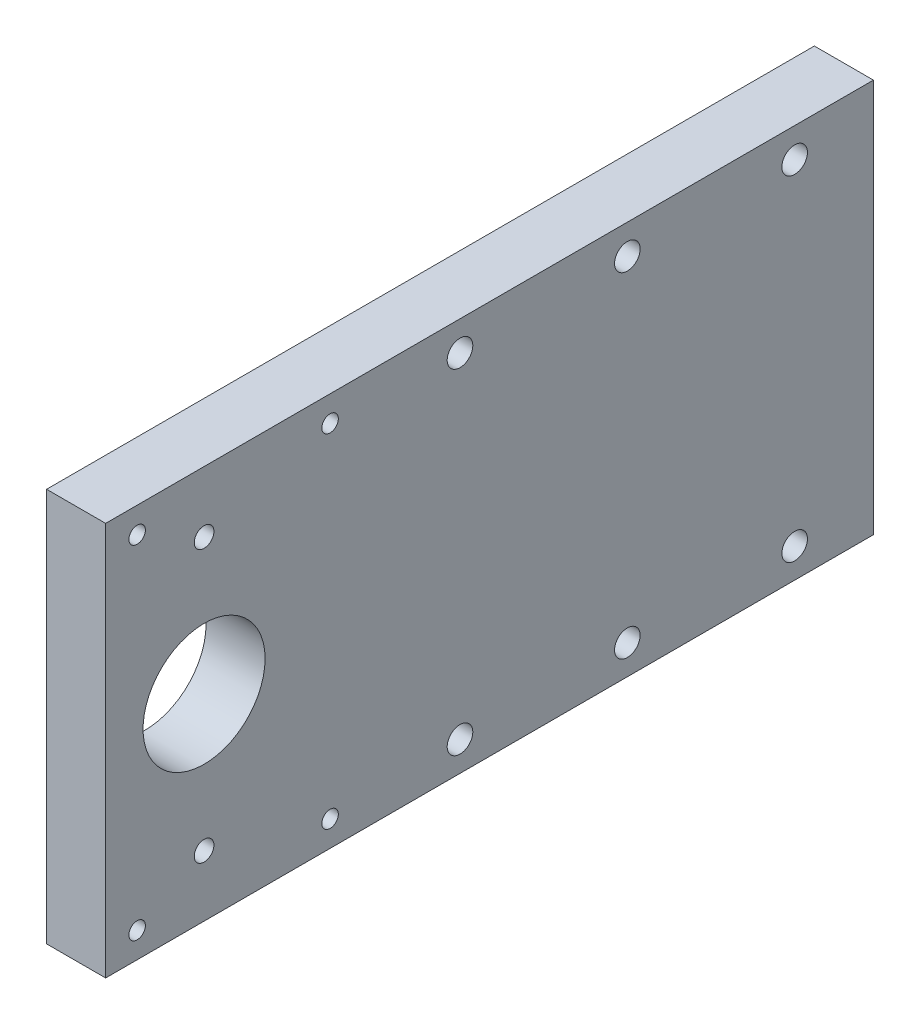
from build123d import *

# Parameters (mm, degrees)
SKETCH11_W                 = 195
SKETCH11_H                 = 100
BOSS_EXTRUDE2_DEPTH        = 15
SKETCH2_R                  = 15.5
CUT_EXTRUDE1_DEPTH         = 202.866292382
M6_TAPPED_HOLE1_D          = 5
M6_TAPPED_HOLE1_DEPTH      = 12
M6_TAPPED_HOLE1_TIP        = 1.502151548
F_6_5_6_5_DIAMETER_HOLE1_D = 6.5
M5_TAPPED_HOLE1_D          = 4.2
M5_TAPPED_HOLE1_DEPTH      = 12
M5_TAPPED_HOLE1_TIP        = 1.2618073
M6_TAPPED_HOLE2_D          = 5


with BuildPart() as part:
    # Sketch11 → Boss-Extrude2 (new body)
    with BuildSketch(Plane(origin=(0, 0, 0), x_dir=(0, 0, -1), z_dir=(1, 0, 0))):
        with Locations((-97.5, 0)):
            Rectangle(SKETCH11_W, SKETCH11_H)
    extrude(amount=-BOSS_EXTRUDE2_DEPTH)

    # Sketch2 → Cut-Extrude1 (cut, through all)
    with BuildSketch(Plane(origin=(0, 0, 0), x_dir=(0, 0, -1), z_dir=(1, 0, 0))):
        with Locations((-170, 0)):
            Circle(SKETCH2_R)
    extrude(amount=-CUT_EXTRUDE1_DEPTH, mode=Mode.SUBTRACT)

    # M6 Tapped Hole1
    with Locations(Plane(origin=(-11.981616001, -34.658638116, 0), x_dir=(-1, 0, 0), z_dir=(0, 0, -1))):
        with Locations((-4.481616001, -0.341361884), (-4.481616001, 69.658638116)):
            Hole(M6_TAPPED_HOLE1_D / 2, depth=M6_TAPPED_HOLE1_DEPTH)
            with Locations((0, 0, -(M6_TAPPED_HOLE1_DEPTH + M6_TAPPED_HOLE1_TIP / 2))):  # 118° drill point
                Cone(0, M6_TAPPED_HOLE1_D / 2, M6_TAPPED_HOLE1_TIP, mode=Mode.SUBTRACT)

    # Ø6.5 (6.5) Diameter Hole1 (through all)
    with Locations(Plane(origin=(0, -7.362824857, 24.874407607), x_dir=(0, 0, -1), z_dir=(1, 0, 0))):
        with Locations((-80.125592393, -35.137175143), (-37.625592393, -35.137175143), (4.874407607, -35.137175143), (-80.125592393, 49.862824857), (-37.625592393, 49.862824857), (4.874407607, 49.862824857)):
            Hole(F_6_5_6_5_DIAMETER_HOLE1_D / 2)

    # M5 Tapped Hole1
    with Locations(Plane(origin=(0, -36.291159976, 74.046897255), x_dir=(0, 0, 1), z_dir=(1, 0, 0))):
        with Locations((63.953102745, 7.208840024), (112.953102745, 7.208840024), (112.953102745, -79.791159976), (63.953102745, -79.791159976)):
            Hole(M5_TAPPED_HOLE1_D / 2, depth=M5_TAPPED_HOLE1_DEPTH)
            with Locations((0, 0, -(M5_TAPPED_HOLE1_DEPTH + M5_TAPPED_HOLE1_TIP / 2))):  # 118° drill point
                Cone(0, M5_TAPPED_HOLE1_D / 2, M5_TAPPED_HOLE1_TIP, mode=Mode.SUBTRACT)

    # M6 Tapped Hole2 (through all)
    with Locations(Plane(origin=(0, -42.104801514, 47.963156397), x_dir=(0, 0, -1), z_dir=(1, 0, 0))):
        with Locations((-122.036843603, 7.604801514), (-122.036843603, 76.604801514)):
            Hole(M6_TAPPED_HOLE2_D / 2)


solid = part.part
